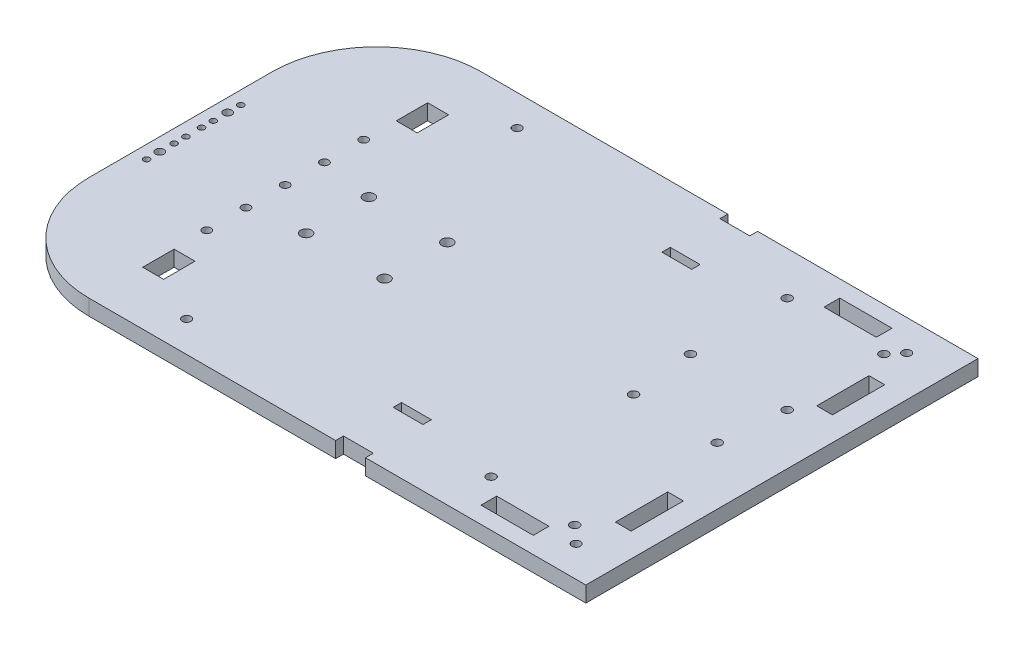
from build123d import *

# Parameters (mm, degrees)
SKETCH1_W           = 230
SKETCH1_H           = 150
BOSS_EXTRUDE1_DEPTH = 6
SKETCH2_W           = 11.4
SKETCH2_H           = 3
SKETCH2_H_2         = 3.2
CUT_EXTRUDE1_DEPTH  = 26
SKETCH3_R           = 2.1
CUT_EXTRUDE2_DEPTH  = 26
SKETCH4_R           = 1.6
CUT_EXTRUDE3_DEPTH  = 26
SKETCH5_R           = 1.175
CUT_EXTRUDE4_DEPTH  = 26
SKETCH6_R           = 1.175
CUT_EXTRUDE5_DEPTH  = 26
SKETCH7_W           = 8
SKETCH7_H           = 12
CUT_EXTRUDE6_DEPTH  = 26
FILLET1_R           = 40
SKETCH8_R           = 1.65
CUT_EXTRUDE7_DEPTH  = 26
SKETCH9_R           = 1.6
CUT_EXTRUDE8_DEPTH  = 10
SKETCH10_R          = 1.7
CUT_EXTRUDE9_DEPTH  = 10
SKETCH12_W          = 20
SKETCH12_H          = 6
SKETCH12_W_2        = 6
SKETCH12_H_2        = 20
CUT_EXTRUDE10_DEPTH = 10


with BuildPart() as part:
    # Sketch1 → Boss-Extrude1 (new body)
    with BuildSketch(Plane(origin=(0, 0, 0), x_dir=(1, 0, 0), z_dir=(0, 1, 0))):
        Rectangle(SKETCH1_W, SKETCH1_H)
    extrude(amount=BOSS_EXTRUDE1_DEPTH)

    # Sketch2 → Cut-Extrude1 (cut)
    with BuildSketch(Plane(origin=(0, 6, 0), x_dir=(1, 0, 0), z_dir=(0, 1, 0))):
        with Locations((25, -73.5)):
            Rectangle(SKETCH2_W, SKETCH2_H)
        with Locations((25, -51.4)):
            Rectangle(SKETCH2_W, SKETCH2_H_2)
    cut_extrude1 = extrude(amount=-CUT_EXTRUDE1_DEPTH, mode=Mode.SUBTRACT)

    # Mirror1: Cut-Extrude1 across plane
    add(cut_extrude1.mirror(Plane.XY), mode=Mode.SUBTRACT)

    # Sketch3 → Cut-Extrude2 (cut)
    with BuildSketch(Plane(origin=(0, 6, 0), x_dir=(1, 0, 0), z_dir=(0, 1, 0))):
        with Locations(Location((-25, -12, 0), (0, 0, 270))):
            Circle(SKETCH3_R)
        with Locations(Location((-25, 12, 0), (0, 0, 270))):
            Circle(SKETCH3_R)
        with Locations(Location((-55, 12, 0), (0, 0, 270))):
            Circle(SKETCH3_R)
        with Locations(Location((-55, -12, 0), (0, 0, 270))):
            Circle(SKETCH3_R)
    extrude(amount=-CUT_EXTRUDE2_DEPTH, mode=Mode.SUBTRACT)

    # Sketch4 → Cut-Extrude3 (cut)
    with BuildSketch(Plane(origin=(0, 6, 0), x_dir=(1, 0, 0), z_dir=(0, 1, 0))):
        with Locations(Location((-75, 0, 0), (0, 0, 270))):
            Circle(SKETCH4_R)
        with Locations(Location((-75, 15, 0), (0, 0, 270))):
            Circle(SKETCH4_R)
        with Locations(Location((-75, 30, 0), (0, 0, 270))):
            Circle(SKETCH4_R)
    cut_extrude3 = extrude(amount=-CUT_EXTRUDE3_DEPTH, mode=Mode.SUBTRACT)

    # Mirror2: Cut-Extrude3 across plane
    add(cut_extrude3.mirror(Plane.XY), mode=Mode.SUBTRACT)

    # Sketch5 → Cut-Extrude4 (cut)
    with BuildSketch(Plane(origin=(0, 6, 0), x_dir=(1, 0, 0), z_dir=(0, 1, 0))):
        with Locations(Location((-110, 7.5, 0), (0, 0, 270))):
            Circle(SKETCH5_R)
        with Locations(Location((-110, -7.5, 0), (0, 0, 270))):
            Circle(SKETCH5_R)
    extrude(amount=-CUT_EXTRUDE4_DEPTH, mode=Mode.SUBTRACT)

    # Sketch6 → Cut-Extrude5 (cut)
    with BuildSketch(Plane(origin=(0, 6, 0), x_dir=(1, 0, 0), z_dir=(0, 1, 0))):
        with Locations(Location((-110, 3, 0), (0, 0, 270))):
            Circle(SKETCH6_R)
        with Locations(Location((-110, 18, 0), (0, 0, 270))):
            Circle(SKETCH6_R)
    cut_extrude5 = extrude(amount=-CUT_EXTRUDE5_DEPTH, mode=Mode.SUBTRACT)

    # Mirror3: Cut-Extrude5 across plane
    add(cut_extrude5.mirror(Plane.XY), mode=Mode.SUBTRACT)

    # Sketch7 → Cut-Extrude6 (cut)
    with BuildSketch(Plane(origin=(0, 6, 0), x_dir=(1, 0, 0), z_dir=(0, 1, 0))):
        with Locations((-71, 48.5)):
            Rectangle(SKETCH7_W, SKETCH7_H)
    cut_extrude6 = extrude(amount=-CUT_EXTRUDE6_DEPTH, mode=Mode.SUBTRACT)

    # Mirror4: Cut-Extrude6 across plane
    add(cut_extrude6.mirror(Plane.XY), mode=Mode.SUBTRACT)

    # Fillet1
    fillet1_edges = [part.edges().sort_by_distance(p)[0] for p in [
        (-115, 3, 75),
        (-115, 3, -75),
    ]]
    fillet(fillet1_edges, radius=FILLET1_R)

    # Sketch8 → Cut-Extrude7 (cut)
    with BuildSketch(Plane(origin=(0, 6, 0), x_dir=(1, 0, 0), z_dir=(0, 1, 0))):
        with Locations(Location((-49.5, 63.212121212, 0), (0, 0, 270))):
            Circle(SKETCH8_R)
        with Locations(Location((-49.5, -63.212121212, 0), (0, 0, 270))):
            Circle(SKETCH8_R)
        with Locations(Location((99.5, -63.212121212, 0), (0, 0, 270))):
            Circle(SKETCH8_R)
        with Locations(Location((99.5, 63.212121212, 0), (0, 0, 270))):
            Circle(SKETCH8_R)
    extrude(amount=-CUT_EXTRUDE7_DEPTH, mode=Mode.SUBTRACT)

    # Sketch9 → Cut-Extrude8 (cut)
    with BuildSketch(Plane(origin=(0, 6, 0), x_dir=(1, 0, 0), z_dir=(0, 1, 0))):
        with Locations(Location((-110, -13, 0), (0, 0, 270))):
            Circle(SKETCH9_R)
    cut_extrude8 = extrude(amount=-CUT_EXTRUDE8_DEPTH, mode=Mode.SUBTRACT)

    # Mirror5: Cut-Extrude8 across plane
    add(cut_extrude8.mirror(Plane.XY), mode=Mode.SUBTRACT)

    # Sketch10 → Cut-Extrude9 (cut)
    with BuildSketch(Plane(origin=(0, 6, 0), x_dir=(1, 0, 0), z_dir=(0, 1, 0))):
        with Locations(Location((58.5, 21.5, 0), (0, 0, 270))):
            Circle(SKETCH10_R)
        with Locations(Location((95.5, 21.5, 0), (0, 0, 270))):
            Circle(SKETCH10_R)
        with Locations(Location((95.5, 58.5, 0), (0, 0, 270))):
            Circle(SKETCH10_R)
        with Locations(Location((58.5, 58.5, 0), (0, 0, 270))):
            Circle(SKETCH10_R)
        with Locations(Location((61, -2.75, 0), (0, 0, 270))):
            Circle(SKETCH10_R)
        with Locations(Location((93, -2.75, 0), (0, 0, 270))):
            Circle(SKETCH10_R)
        with Locations(Location((61, -57.25, 0), (0, 0, 270))):
            Circle(SKETCH10_R)
        with Locations(Location((93, -57.25, 0), (0, 0, 270))):
            Circle(SKETCH10_R)
    extrude(amount=-CUT_EXTRUDE9_DEPTH, mode=Mode.SUBTRACT)

    # Sketch12 → Cut-Extrude10 (cut)
    with BuildSketch(Plane(origin=(0, 6, 0), x_dir=(1, 0, 0), z_dir=(0, 1, 0))):
        with Locations((78.5, 65.605966129)):
            Rectangle(SKETCH12_W, SKETCH12_H)
        with Locations((102.815499503, 38.5)):
            Rectangle(SKETCH12_W_2, SKETCH12_H_2)
    cut_extrude10 = extrude(amount=-CUT_EXTRUDE10_DEPTH, mode=Mode.SUBTRACT)

    # Mirror6: Cut-Extrude10 across plane
    add(cut_extrude10.mirror(Plane.XY), mode=Mode.SUBTRACT)


solid = part.part
